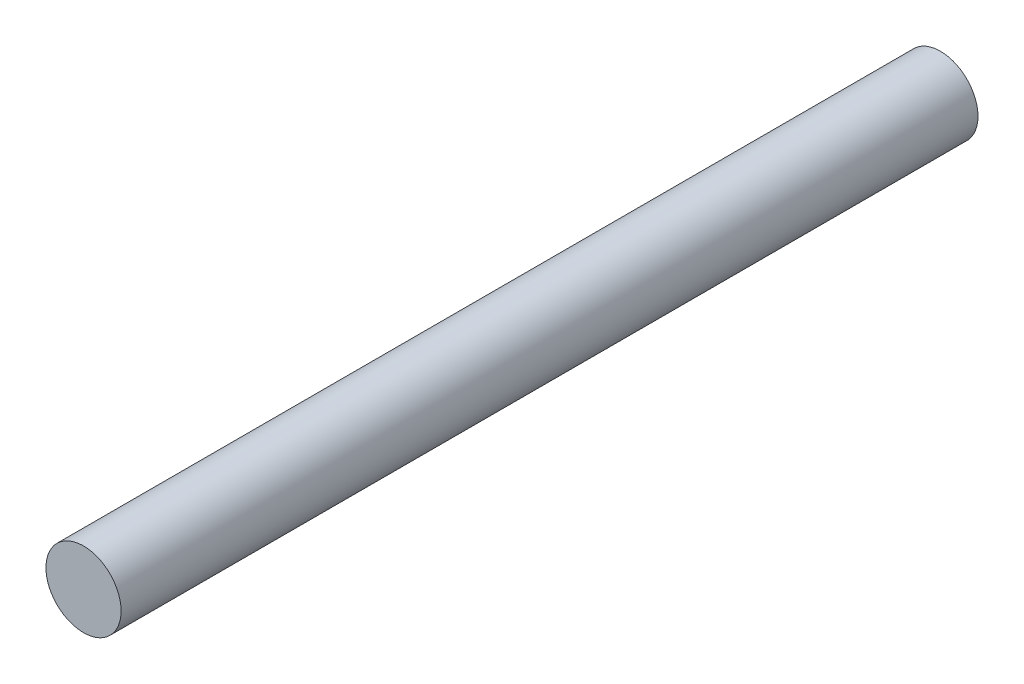
from build123d import *

# Parameters (mm, degrees)
SKETCH2_R           = 0.97155
BOSS_EXTRUDE2_DEPTH = 22.1488


with BuildPart() as part:
    # Sketch2 → Boss-Extrude2 (new body)
    with BuildSketch(Plane.XY):
        Circle(SKETCH2_R)
    extrude(amount=BOSS_EXTRUDE2_DEPTH)


solid = part.part
